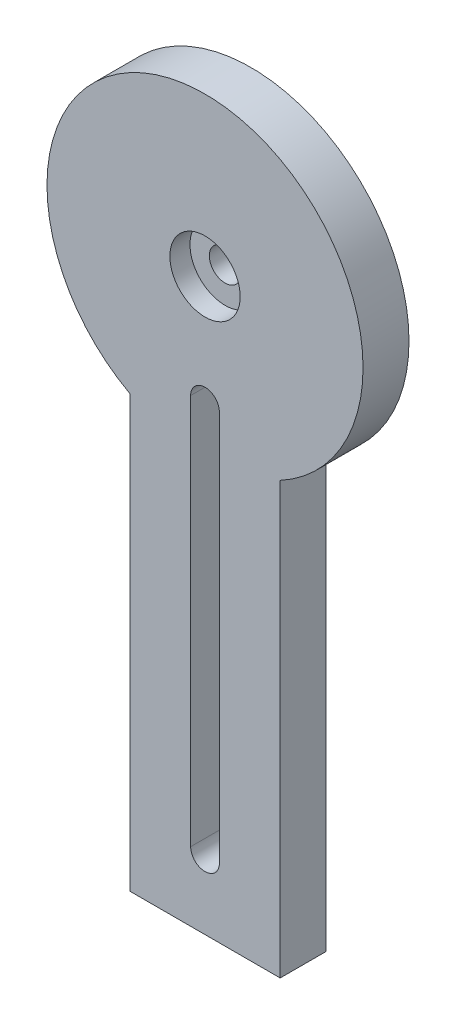
from build123d import *

# Parameters (mm, degrees)
ESTRUSIONE_ESTRUSIONE1_DEPTH                         = 4
TAGLIO_ESTRUSIONE1_DEPTH                             = 134.270896221
FORO_LAMATO_PER_BULLONE_M5_A_TESTA_ESAGO_D           = 5.5
FORO_LAMATO_PER_BULLONE_M5_A_TESTA_ESAGO_CBORE_D     = 12.238
FORO_LAMATO_PER_BULLONE_M5_A_TESTA_ESAGO_CBORE_DEPTH = 3.5


with BuildPart() as part:
    # Schizzo1 → Estrusione-Estrusione1 (new, symmetric)
    with BuildSketch(Plane.XY):
        with BuildLine():
            Line((0, 0), (0, 75))
            ThreePointArc((0, 75), (13.08, 126.690155022), (26.16, 75))
            Line((26.16, 75), (26.16, 0))
            Line((26.16, 0), (0, 0))
        make_face()
    extrude(amount=ESTRUSIONE_ESTRUSIONE1_DEPTH, both=True)

    # Schizzo2 → Taglio-Estrusione1 (cut, through all)
    with BuildSketch(Plane.XY.offset(4)):
        with BuildLine():
            Line((10.58, 12), (10.58, 80))
            ThreePointArc((10.58, 80), (13.08, 82.5), (15.58, 80))
            Line((15.58, 80), (15.58, 12))
            ThreePointArc((15.58, 12), (13.08, 9.5), (10.58, 12))
        make_face()
    extrude(amount=-TAGLIO_ESTRUSIONE1_DEPTH, mode=Mode.SUBTRACT)

    # Foro lamato per Bullone M5 a testa esagonale-1 (through all)
    with Locations(Plane.XY.offset(4)):
        with Locations((13.08, 99.190155022)):
            CounterBoreHole(FORO_LAMATO_PER_BULLONE_M5_A_TESTA_ESAGO_D / 2, FORO_LAMATO_PER_BULLONE_M5_A_TESTA_ESAGO_CBORE_D / 2, FORO_LAMATO_PER_BULLONE_M5_A_TESTA_ESAGO_CBORE_DEPTH)


solid = part.part
